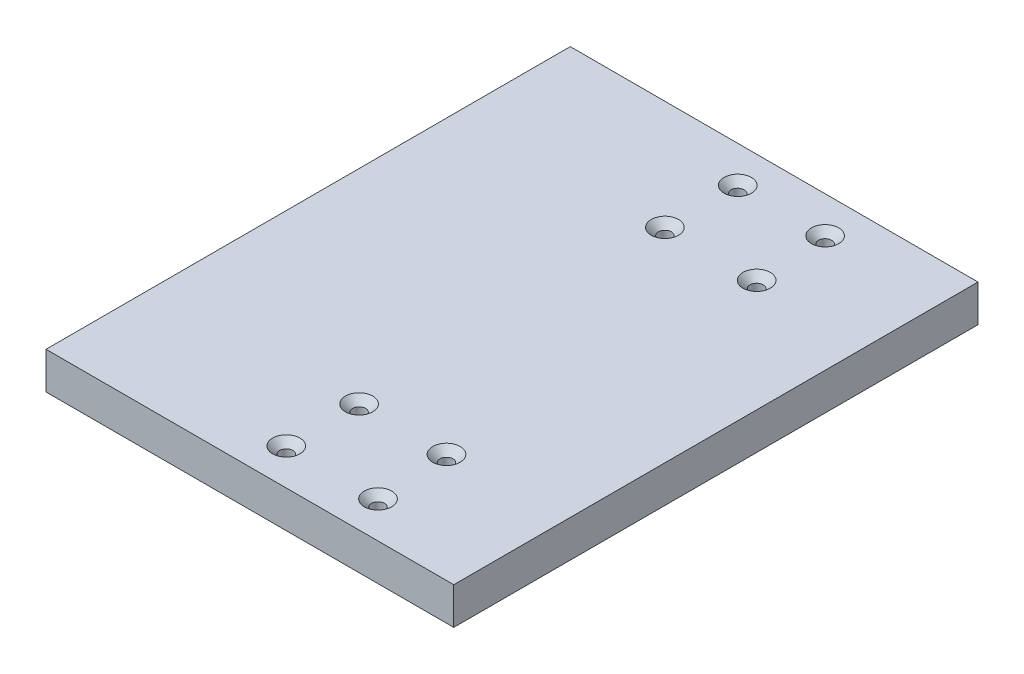
from build123d import *

# Parameters (mm, degrees)
SKETCH1_W                                       = 140
SKETCH1_H                                       = 180
BOSS_EXTRUDE1_DEPTH                             = 12.7
CSK_FOR_M4_FLAT_HEAD_MACHINE_SCREW1_D           = 4.5
CSK_FOR_M4_FLAT_HEAD_MACHINE_SCREW1_CSINK_D     = 9.4
CSK_FOR_M4_FLAT_HEAD_MACHINE_SCREW1_CSINK_ANGLE = 90


with BuildPart() as part:
    # Sketch1 → Boss-Extrude1 (new body)
    with BuildSketch(Plane(origin=(0, 0, 0), x_dir=(1, 0, 0), z_dir=(0, 1, 0))):
        Rectangle(SKETCH1_W, SKETCH1_H)
    extrude(amount=BOSS_EXTRUDE1_DEPTH)

    # CSK for M4 Flat Head Machine Screw1 (through all)
    with Locations(Plane(origin=(0, 12.7, 0), x_dir=(1, 0, 0), z_dir=(0, 1, 0))):
        with Locations((0, -52.5), (30, -52.5), (31.487677762, -77.5), (0, -77.5), (0, 77.5), (30, 77.5), (31.487677762, 52.5), (0, 52.5)):
            CounterSinkHole(CSK_FOR_M4_FLAT_HEAD_MACHINE_SCREW1_D / 2, CSK_FOR_M4_FLAT_HEAD_MACHINE_SCREW1_CSINK_D / 2, counter_sink_angle=CSK_FOR_M4_FLAT_HEAD_MACHINE_SCREW1_CSINK_ANGLE)


solid = part.part
